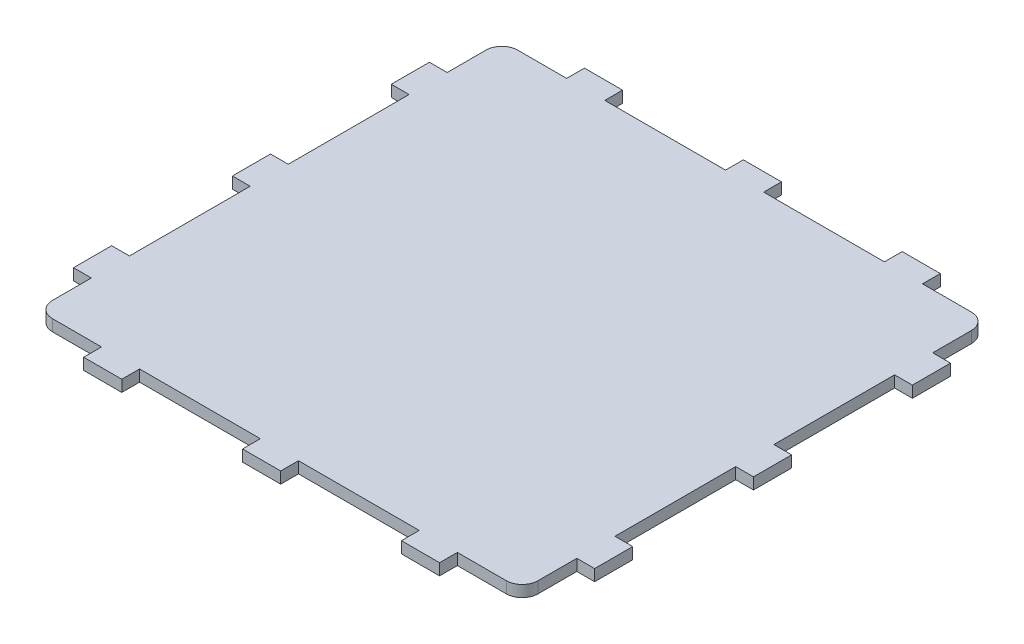
from build123d import *

# Parameters (mm, degrees)
SKETCH_1_W               = 764
SKETCH_1_H               = 732
EXTRUDE_1_DEPTH          = 18
SKETCH_1_3_W             = 28
SKETCH_1_3_H             = 60
EXTRUDE_2_DEPTH          = 18
PATTERN_LINEAR_1_COUNT   = 3
PATTERN_LINEAR_1_PITCH   = 250
MIRROR_1_COPY_1_SKETCH_W = 28
MIRROR_1_COPY_1_SKETCH_H = 60
MIRROR_1_COPY_1_DEPTH    = 18
MIRROR_1_COPY_2_SKETCH_W = 28
MIRROR_1_COPY_2_SKETCH_H = 60
MIRROR_1_COPY_2_DEPTH    = 18
SKETCH_1_5_W             = 60
SKETCH_1_5_H             = 28
EXTRUDE_3_DEPTH          = 18
PATTERN_LINEAR_2_COUNT   = 3
PATTERN_LINEAR_2_PITCH   = 250
MIRROR_2_COPY_1_SKETCH_W = 60
MIRROR_2_COPY_1_SKETCH_H = 28
MIRROR_2_COPY_1_DEPTH    = 18
MIRROR_2_COPY_2_SKETCH_W = 60
MIRROR_2_COPY_2_SKETCH_H = 28
MIRROR_2_COPY_2_DEPTH    = 18
FILLET_1_R               = 25


with BuildPart() as part:
    # 草图1 → 凸台-拉伸1 (new body)
    with BuildSketch(Plane(origin=(0, 0, 0), x_dir=(1, 0, 0), z_dir=(0, 1, 0))):
        Rectangle(SKETCH_1_W, SKETCH_1_H)
    extrude(amount=EXTRUDE_1_DEPTH)

    # 草图1<3> → 凸台-拉伸2 (add)
    with BuildSketch(Plane(origin=(0, 0, 0), x_dir=(1, 0, 0), z_dir=(0, 1, 0))):
        with Locations((-396, -250)):
            Rectangle(SKETCH_1_3_W, SKETCH_1_3_H)
    extrude_2 = extrude(amount=EXTRUDE_2_DEPTH)

    # 阵列(线性)1: 凸台-拉伸2 ×3
    with Locations(*[(0, 0, -i * PATTERN_LINEAR_1_PITCH) for i in range(1, PATTERN_LINEAR_1_COUNT)]):
        add(extrude_2)

    # 镜向1: 凸台-拉伸2 across plane
    add(extrude_2.mirror(Plane(origin=(0, 0, 0), x_dir=(0, 0, 1), z_dir=(1, 0, 0))))

    # 镜向1 copy 1 sketch → 镜向1 copy 1 (add)
    with BuildSketch(Plane(origin=(0, 0, -250), x_dir=(-1, 0, 0), z_dir=(0, 1, 0))):
        with Locations((-396, 250)):
            Rectangle(MIRROR_1_COPY_1_SKETCH_W, MIRROR_1_COPY_1_SKETCH_H)
    extrude(amount=MIRROR_1_COPY_1_DEPTH)

    # 镜向1 copy 2 sketch → 镜向1 copy 2 (add)
    with BuildSketch(Plane(origin=(0, 0, -500), x_dir=(-1, 0, 0), z_dir=(0, 1, 0))):
        with Locations((-396, 250)):
            Rectangle(MIRROR_1_COPY_2_SKETCH_W, MIRROR_1_COPY_2_SKETCH_H)
    extrude(amount=MIRROR_1_COPY_2_DEPTH)

    # 草图1<5> → 凸台-拉伸3 (add)
    with BuildSketch(Plane(origin=(0, 0, 0), x_dir=(1, 0, 0), z_dir=(0, 1, 0))):
        with Locations((-250, -380)):
            Rectangle(SKETCH_1_5_W, SKETCH_1_5_H)
    extrude_3 = extrude(amount=EXTRUDE_3_DEPTH)

    # 阵列(线性)2: 凸台-拉伸3 ×3
    with Locations(*[(i * PATTERN_LINEAR_2_PITCH, 0, 0) for i in range(1, PATTERN_LINEAR_2_COUNT)]):
        add(extrude_3)

    # 镜向2: 凸台-拉伸3 across plane
    add(extrude_3.mirror(Plane.XY))

    # 镜向2 copy 1 sketch → 镜向2 copy 1 (add)
    with BuildSketch(Plane(origin=(250, 0, 0), x_dir=(1, 0, 0), z_dir=(0, 1, 0))):
        with Locations((-250, 380)):
            Rectangle(MIRROR_2_COPY_1_SKETCH_W, MIRROR_2_COPY_1_SKETCH_H)
    extrude(amount=MIRROR_2_COPY_1_DEPTH)

    # 镜向2 copy 2 sketch → 镜向2 copy 2 (add)
    with BuildSketch(Plane(origin=(500, 0, 0), x_dir=(1, 0, 0), z_dir=(0, 1, 0))):
        with Locations((-250, 380)):
            Rectangle(MIRROR_2_COPY_2_SKETCH_W, MIRROR_2_COPY_2_SKETCH_H)
    extrude(amount=MIRROR_2_COPY_2_DEPTH)

    # 圆角1
    fillet_1_edges = [part.edges().sort_by_distance(p)[0] for p in [
        (-382, 9, -366),
        (-382, 9, 366),
        (382, 9, 366),
        (382, 9, -366),
    ]]
    fillet(fillet_1_edges, radius=FILLET_1_R)


solid = part.part
